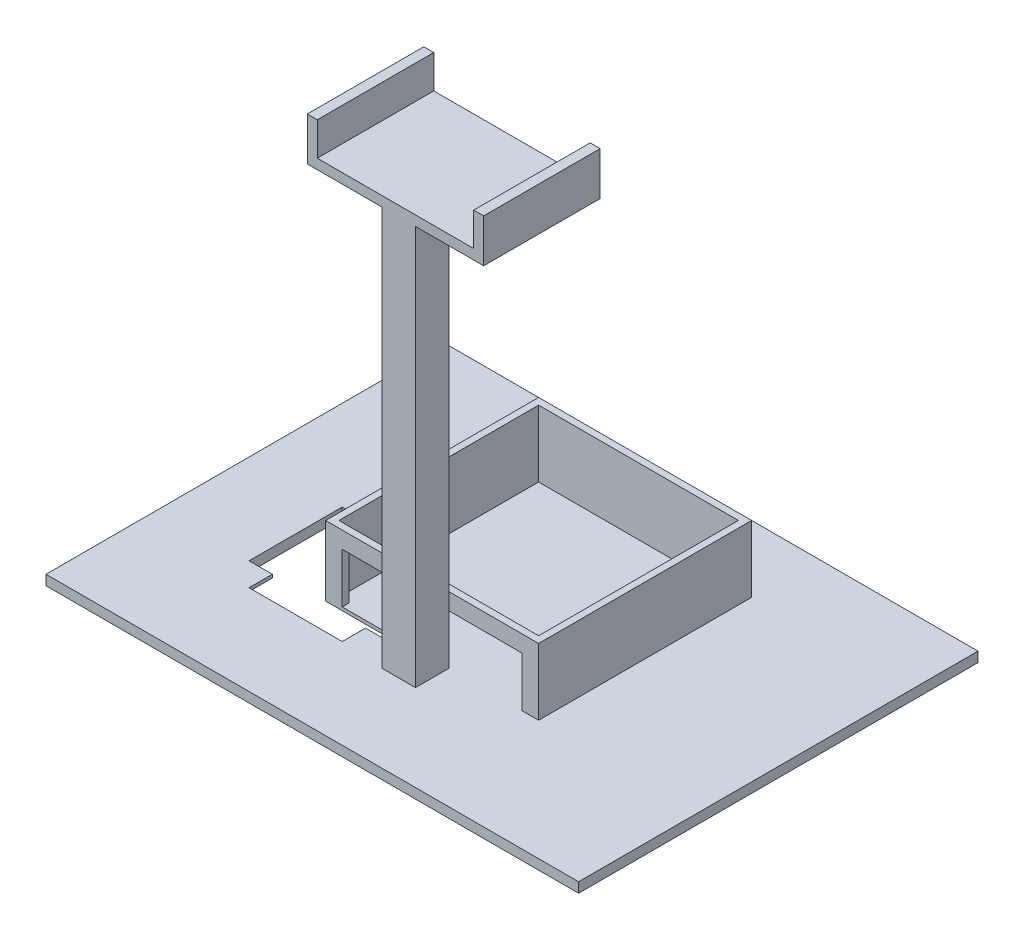
from build123d import *

# Parameters (mm, degrees)
SKETCH1_W           = 160
SKETCH1_H           = 120
BOSS_EXTRUDE1_DEPTH = 3
SKETCH2_R           = 5
CUT_EXTRUDE1_DEPTH  = 2
SKETCH3_W           = 42
SKETCH3_H           = 42
CUT_EXTRUDE2_DEPTH  = 2
CUT_EXTRUDE3_DEPTH  = 1
BOSS_EXTRUDE2_DEPTH = 20
BOSS_EXTRUDE3_DEPTH = 1
SKETCH7_W           = 60
SKETCH7_H           = 60
CUT_EXTRUDE4_DEPTH  = 20
CUT_EXTRUDE5_REACH  = 120.258
SKETCH8_W           = 54
SKETCH8_H           = 15
BOSS_EXTRUDE4_DEPTH = 120
BOSS_EXTRUDE5_DEPTH = 3
SKETCH11_W          = 3
SKETCH11_H          = 35
BOSS_EXTRUDE6_DEPTH = 10


with BuildPart() as part:
    # Sketch1 → Boss-Extrude1 (new body)
    with BuildSketch(Plane(origin=(0, 0, 0), x_dir=(1, 0, 0), z_dir=(0, 1, 0))):
        Rectangle(SKETCH1_W, SKETCH1_H)
    extrude(amount=BOSS_EXTRUDE1_DEPTH)

    # Sketch2 → Cut-Extrude1 (cut)
    with BuildSketch(Plane.XZ):
        with Locations(Location((-70, 50, 0), (0, 0, 270))):
            Circle(SKETCH2_R)
        with Locations(Location((0, 50, 0), (0, 0, 270))):
            Circle(SKETCH2_R)
        with Locations(Location((70, 50, 0), (0, 0, 270))):
            Circle(SKETCH2_R)
        with Locations(Location((-70, 0, 0), (0, 0, 270))):
            Circle(SKETCH2_R)
        with Locations(Location((70, 0, 0), (0, 0, 270))):
            Circle(SKETCH2_R)
        with Locations(Location((-70, -50, 0), (0, 0, 270))):
            Circle(SKETCH2_R)
        with Locations(Location((0, -50, 0), (0, 0, 270))):
            Circle(SKETCH2_R)
        with Locations(Location((70, -50, 0), (0, 0, 270))):
            Circle(SKETCH2_R)
    extrude(amount=-CUT_EXTRUDE1_DEPTH, mode=Mode.SUBTRACT)

    # Sketch3 → Cut-Extrude2 (cut)
    with BuildSketch(Plane.XZ):
        with Locations((-32, 12)):
            Rectangle(SKETCH3_W, SKETCH3_H)
    extrude(amount=-CUT_EXTRUDE2_DEPTH, mode=Mode.SUBTRACT)

    # Sketch4 → Cut-Extrude3 (cut)
    with BuildSketch(Plane.XZ.offset(-2)):
        Polygon((-46, 33), (-18, 33), (-18, 26), (-11, 26), (-11, -2), (-18, -2), (-18, -9), (-46, -9), (-46, -2), (-53, -2), (-53, 26), (-46, 26), align=None)
    extrude(amount=-CUT_EXTRUDE3_DEPTH, mode=Mode.SUBTRACT)

    # Sketch5 → Boss-Extrude2 (add)
    with BuildSketch(Plane(origin=(0, 3, 0), x_dir=(1, 0, 0), z_dir=(0, 1, 0))):
        Polygon((0, 40), (-32, 40), (-32, -24), (32, -24), (32, 40), align=None)
    extrude(amount=BOSS_EXTRUDE2_DEPTH)

    # Sketch6 → Boss-Extrude3 (add)
    with BuildSketch(Plane.XZ.offset(-3)):
        Polygon((-32, 24), (-11, 24), (-11, -2), (-18, -2), (-18, -9), (-32, -9), align=None)
    extrude(amount=BOSS_EXTRUDE3_DEPTH)

    # Sketch7 → Cut-Extrude4 (cut)
    with BuildSketch(Plane(origin=(0, 23, 0), x_dir=(1, 0, 0), z_dir=(0, 1, 0))):
        with Locations((0, 8)):
            Rectangle(SKETCH7_W, SKETCH7_H)
    extrude(amount=-CUT_EXTRUDE4_DEPTH, mode=Mode.SUBTRACT)

    # Sketch8 → Cut-Extrude5 (cut, up to next)
    with BuildSketch(Plane.XY.offset(24), mode=Mode.PRIVATE) as cut_extrude5_sk1:
        with Locations((0, 10.5)):
            Rectangle(SKETCH8_W, SKETCH8_H)
    cut_extrude5_tool1 = extrude(cut_extrude5_sk1.sketch, amount=-CUT_EXTRUDE5_REACH, mode=Mode.PRIVATE) & part.part
    add(cut_extrude5_tool1.solids().sort_by_distance((0, 10.5, 24))[0], mode=Mode.SUBTRACT)

    # Sketch9 → Boss-Extrude4 (add)
    with BuildSketch(Plane(origin=(0, 3, 0), x_dir=(1, 0, 0), z_dir=(0, 1, 0))):
        Polygon((0, -24), (5, -24), (5, -34), (-5, -34), (-5, -24), align=None)
    extrude(amount=BOSS_EXTRUDE4_DEPTH)

    # Sketch10 → Boss-Extrude5 (add)
    with BuildSketch(Plane(origin=(0, 123, 0), x_dir=(1, 0, 0), z_dir=(0, 1, 0))):
        Polygon((0, -34), (25.5, -34), (25.5, 1), (-27.5, 1), (-27.5, -34), align=None)
    extrude(amount=BOSS_EXTRUDE5_DEPTH)

    # Sketch11 → Boss-Extrude6 (add)
    with BuildSketch(Plane(origin=(0, 126, 0), x_dir=(1, 0, 0), z_dir=(0, 1, 0))):
        with Locations((24, -16.5)):
            Rectangle(SKETCH11_W, SKETCH11_H)
        with Locations((-26, -16.5)):
            Rectangle(SKETCH11_W, SKETCH11_H)
    extrude(amount=BOSS_EXTRUDE6_DEPTH)


solid = part.part
